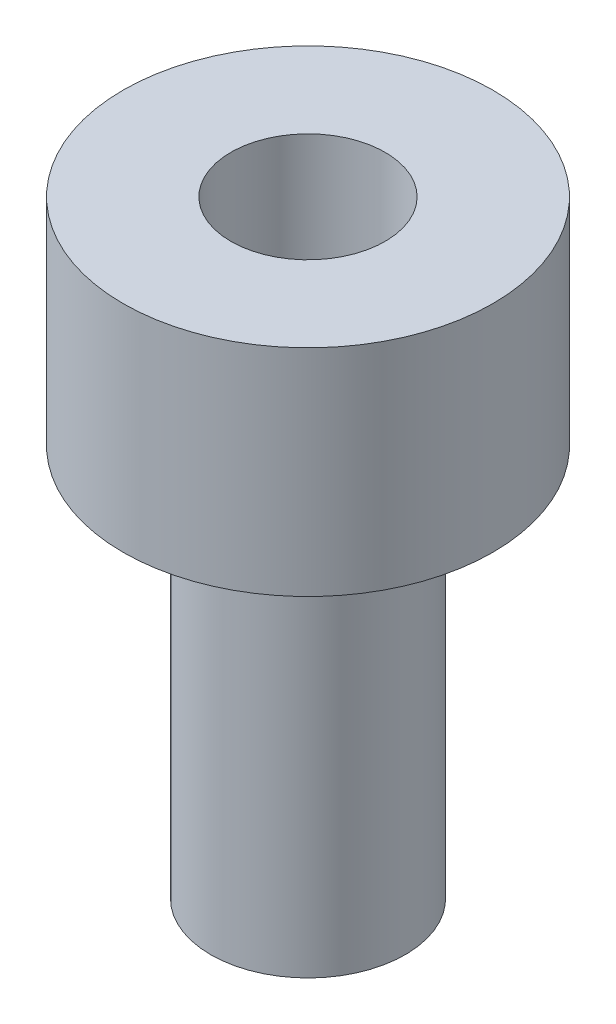
from build123d import *

# Parameters (mm, degrees)
SKETCH1_R           = 3.025
BOSS_EXTRUDE1_DEPTH = 12.2
SKETCH2_R           = 5.75
SKETCH2_R_2         = 2.4
BOSS_EXTRUDE2_DEPTH = 6.7
SKETCH3_R           = 2.4
BOSS_EXTRUDE3_DEPTH = 1.4


with BuildPart() as part:
    # Sketch1 → Boss-Extrude1 (new body)
    with BuildSketch(Plane(origin=(0, 0, 0), x_dir=(1, 0, 0), z_dir=(0, 1, 0))):
        with Locations(Location((0, 0, 0), (0, 0, 270))):
            Circle(SKETCH1_R)
    extrude(amount=BOSS_EXTRUDE1_DEPTH)

    # Sketch2 → Boss-Extrude2 (add)
    with BuildSketch(Plane(origin=(0, 12.2, 0), x_dir=(1, 0, 0), z_dir=(0, 1, 0))):
        with Locations(Location((0, 0, 0), (0, 0, 270))):
            Circle(SKETCH2_R)
        with Locations(Location((0, 0, 0), (0, 0, 270))):
            Circle(SKETCH2_R_2, mode=Mode.SUBTRACT)
    extrude(amount=BOSS_EXTRUDE2_DEPTH)

    # Sketch3 → Boss-Extrude3 (add)
    with BuildSketch(Plane(origin=(0, 12.2, 0), x_dir=(1, 0, 0), z_dir=(0, 1, 0))):
        with Locations(Location((0, 0, 0), (0, 0, 270))):
            Circle(SKETCH3_R)
    extrude(amount=BOSS_EXTRUDE3_DEPTH)


solid = part.part
